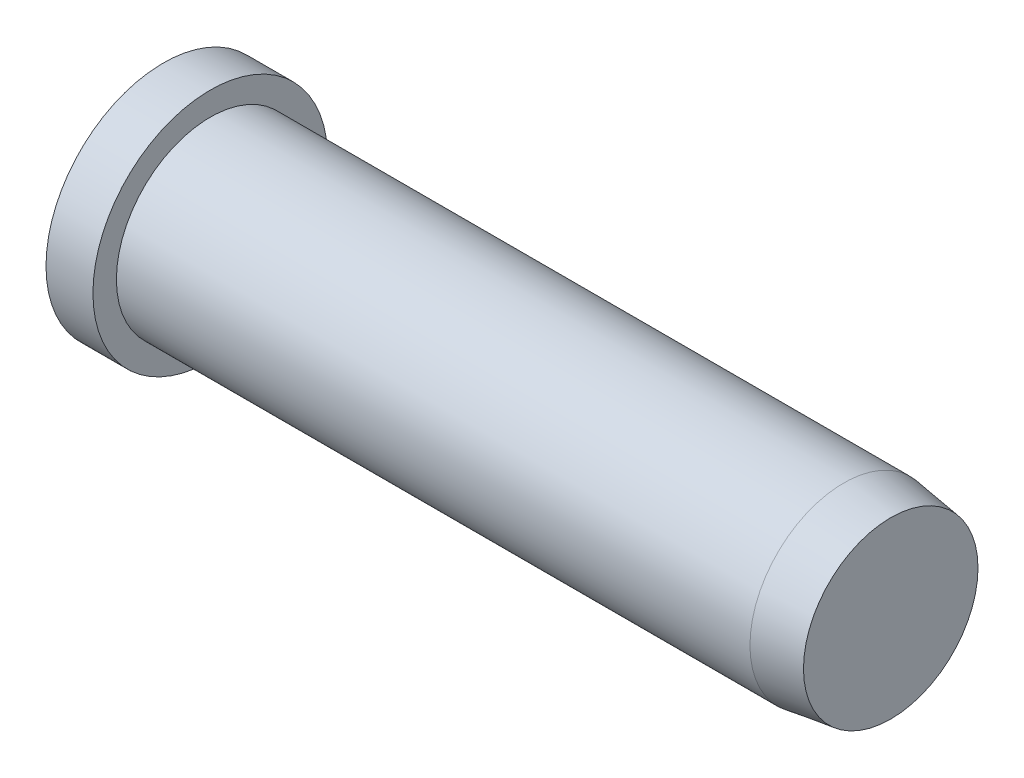
from build123d import *

# Parameters (mm, degrees)
CHAMFER1_SIZE  = 10
CHAMFER1_SIZE2 = 1.405408347


with BuildPart() as part:
    # Sketch1 → Revolve1 (revolve)
    with BuildSketch(Plane(origin=(0, 0, 0), x_dir=(1, 0, 0), z_dir=(0, 1, 0)), mode=Mode.PRIVATE) as revolve1_sk:
        Polygon((0, 0), (155, 0), (155, 20), (10, 20), (10, 25), (0, 25), align=None)
    revolve(revolve1_sk.sketch.rotate(Axis((0, 0, 0), (1, 0, 0)), 180), axis=Axis((0, 0, 0), (1, 0, 0)))

    # Chamfer1
    chamfer1_edges = [part.edges().sort_by_distance(p)[0] for p in [
        (155, 0, -20),
    ]]
    chamfer1_side = [part.faces().sort_by_distance(p)[0] for p in [
        (82.5, 0, -20),
    ]]
    chamfer(chamfer1_edges, length=CHAMFER1_SIZE, length2=CHAMFER1_SIZE2, reference=chamfer1_side[0])


solid = part.part
